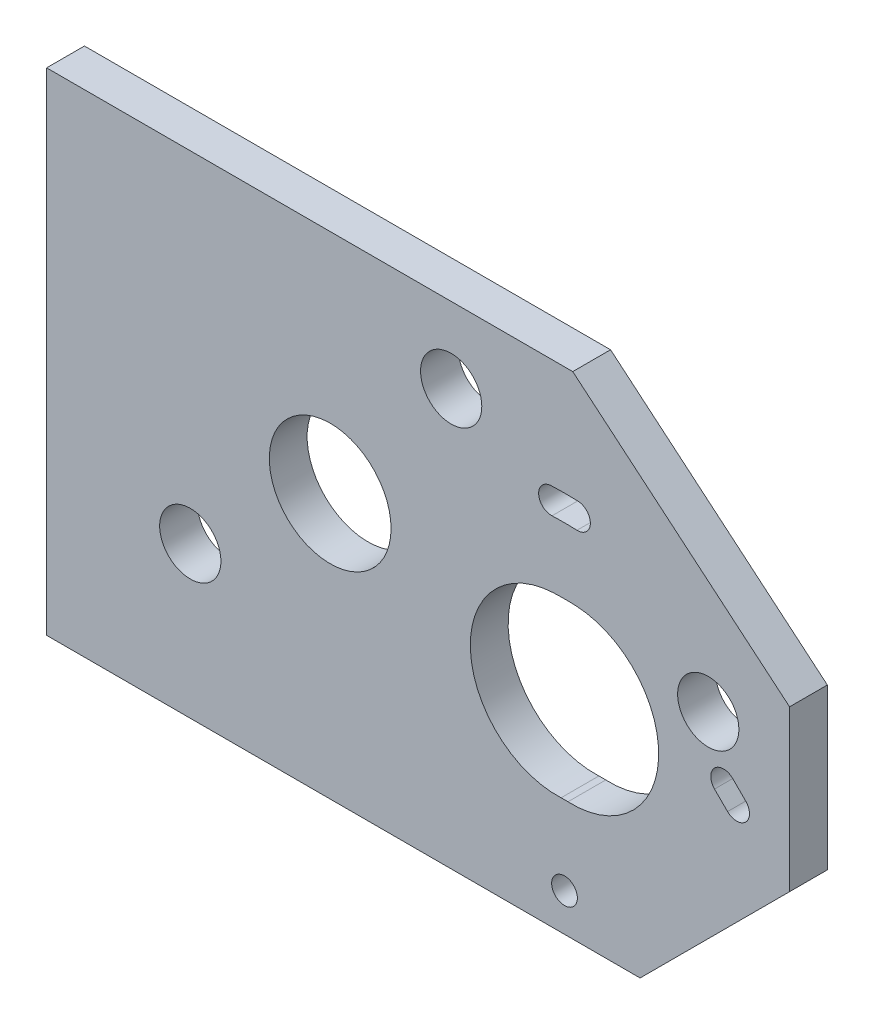
from build123d import *

# Parameters (mm, degrees)
SKETCH1_R           = 4.05
SKETCH1_R_2         = 1.7
SKETCH1_R_3         = 8.05
BOSS_EXTRUDE1_DEPTH = 5


with BuildPart() as part:
    # Sketch1 → Boss-Extrude1 (new body)
    with BuildSketch(Plane.XY):
        Polygon((32.079048784, 30), (-37.5, 30), (-37.5, -35), (40.987000641, -35), (60.75120914, -15.235791501), (60.75120914, 5.94120082), align=None)
        with Locations((16, 20)):
            Circle(SKETCH1_R, mode=Mode.SUBTRACT)
        with Locations((50, 0)):
            Circle(SKETCH1_R, mode=Mode.SUBTRACT)
        with Locations((-18.5, -15)):
            Circle(SKETCH1_R, mode=Mode.SUBTRACT)
        with Locations((30.987000641, -30)):
            Circle(SKETCH1_R_2, mode=Mode.SUBTRACT)
        Circle(SKETCH1_R_3, mode=Mode.SUBTRACT)
        with BuildLine():
            Line((53.231228952, -6.031636678), (54.952673272, -7.751314072))
            ThreePointArc((54.952673272, -7.751314072), (54.953907747, -10.155476811), (52.549745008, -10.156711286))
            Line((52.549745008, -10.156711286), (50.828300688, -8.437033892))
            ThreePointArc((50.828300688, -8.437033892), (50.827066213, -6.032871153), (53.231228952, -6.031636678))
        make_face(mode=Mode.SUBTRACT)
        with BuildLine():
            ThreePointArc((29.199069372, 15.505889539), (30.987000641, 15.541), (32.774931911, 15.505889539))
            ThreePointArc((32.774931911, 15.505889539), (34.406879586, 13.740458491), (32.641448537, 12.108510816))
            ThreePointArc((32.641448537, 12.108510816), (30.987000641, 12.141), (29.332552745, 12.108510816))
            ThreePointArc((29.332552745, 12.108510816), (27.567121697, 13.740458491), (29.199069372, 15.505889539))
        make_face(mode=Mode.SUBTRACT)
        with BuildLine():
            ThreePointArc((29.529218906, 3.388691089), (30.987000641, 3.4205), (32.444782377, 3.388691089))
            ThreePointArc((32.444782377, 3.388691089), (43.43221397, -8.601986414), (31.441536467, -19.589418007))
            ThreePointArc((31.441536467, -19.589418007), (30.987000641, -19.5795), (30.532464815, -19.589418007))
            ThreePointArc((30.532464815, -19.589418007), (18.541787312, -8.601986414), (29.529218906, 3.388691089))
        make_face(mode=Mode.SUBTRACT)
    extrude(amount=BOSS_EXTRUDE1_DEPTH)


solid = part.part
